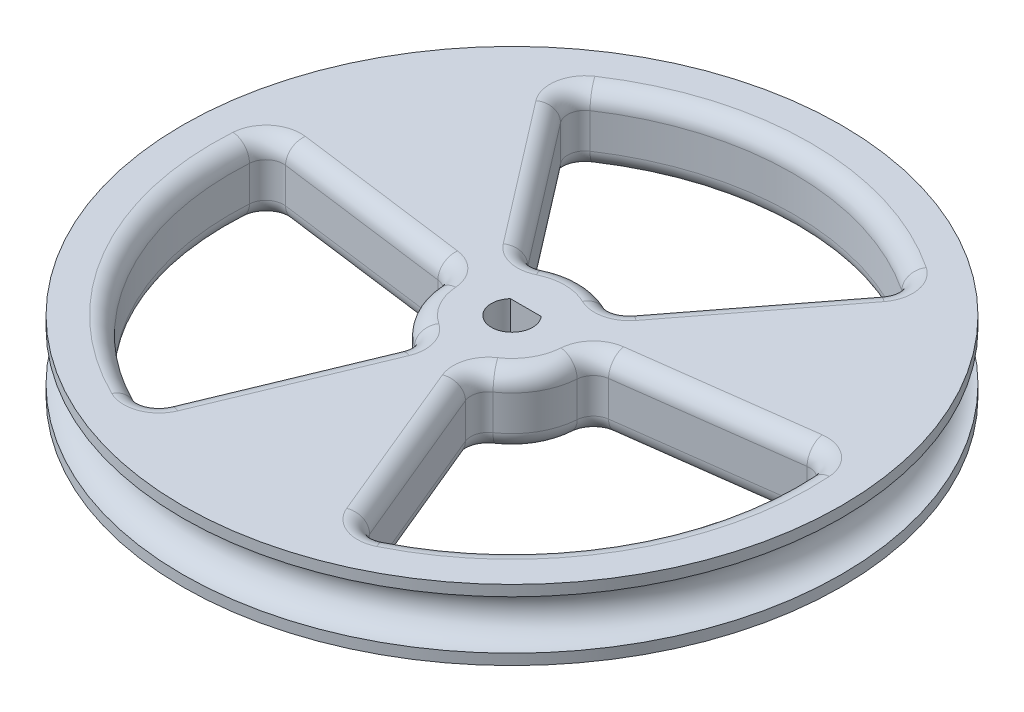
from build123d import *

# Parameters (mm, degrees)
SKETCH1_R                 = 23.815610662
BOSS_EXTRUDE1_DEPTH       = 5.08
CUT_EXTRUDE1_DEPTH        = 5.08
CUT_EXTRUDE3_DEPTH        = 35.061312694
FILLET22_R                = 1.27
CIRPATTERN1_COUNT         = 3
FILLET22_OF_CIRPATTERN1_R = 1.27


with BuildPart() as part:
    # Sketch1 → Boss-Extrude1 (new body)
    with BuildSketch(Plane(origin=(0, 0, 0), x_dir=(1, 0, 0), z_dir=(0, 1, 0))):
        with Locations(Location((0, 0, 0), (0, 0, 270))):
            Circle(SKETCH1_R)
    extrude(amount=BOSS_EXTRUDE1_DEPTH)

    # Sketch2 → Cut-Extrude1 (cut)
    with BuildSketch(Plane(origin=(0, 5.08, 0), x_dir=(1, 0, 0), z_dir=(0, 1, 0))):
        with BuildLine():
            Line((-1.114562695, 0.99225), (1.114562695, 0.99225))
            ThreePointArc((1.114562695, 0.99225), (0, -1.49225), (-1.114562695, 0.99225))
        make_face()
    extrude(amount=-CUT_EXTRUDE1_DEPTH, mode=Mode.SUBTRACT)

    # Sketch5 → Cut-Revolve2 (revolve, cut)
    with BuildSketch(Plane.XY, mode=Mode.PRIVATE) as cut_revolve2_sk:
        with BuildLine():
            Line((-23.815610662, 4.3053), (-23.815610662, 0.7747))
            ThreePointArc((-23.815610662, 0.7747), (-22.050310662, 2.54), (-23.815610662, 4.3053))
        make_face()
    revolve(cut_revolve2_sk.sketch.rotate(Axis((0, 4.3287014, 0), (0, -1, 0)), 270), axis=Axis((0, 4.3287014, 0), (0, -1, 0)), mode=Mode.SUBTRACT)

    # Sketch8 → Cut-Extrude3 (cut, through all)
    with BuildSketch(Plane(origin=(0, 5.08, 0), x_dir=(1, 0, 0), z_dir=(0, 1, 0))):
        with BuildLine():
            Line((3.092508059, 4.030234969), (12.370032237, 16.120939875))
            ThreePointArc((12.370032237, 16.120939875), (0, 20.32), (-12.370032237, 16.120939875))
            Line((-12.370032237, 16.120939875), (-3.092508059, 4.030234969))
            ThreePointArc((-3.092508059, 4.030234969), (0, 5.08), (3.092508059, 4.030234969))
        make_face()
    cut_extrude3 = extrude(amount=-CUT_EXTRUDE3_DEPTH, mode=Mode.SUBTRACT)

    # Fillet22
    fillet22_edges = [part.edges().sort_by_distance(p)[0] for p in [
        (-7.731270148, 0, -10.075587422),
        (-3.092508059, 2.54, -4.030234969),
        (0, 5.08, -20.32),
        (-12.370032237, 2.54, -16.120939875),
        (7.731270148, 0, -10.075587422),
        (12.370032237, 2.54, -16.120939875),
        (0, 0, -5.08),
        (3.092508059, 2.54, -4.030234969),
        (0, 0, -20.32),
        (-7.731270148, 5.08, -10.075587422),
        (0, 5.08, -5.08),
        (7.731270148, 5.08, -10.075587422),
    ]]
    fillet(fillet22_edges, radius=FILLET22_R)

    # CirPattern1: Cut-Extrude3 ×3 about axis
    cirpattern1_axis = Axis((0, 5.08, 0), (0, 1, 0))
    for i in range(1, CIRPATTERN1_COUNT):
        add(cut_extrude3.rotate(cirpattern1_axis, i * 360 / CIRPATTERN1_COUNT), mode=Mode.SUBTRACT)

    # Fillet22 of CirPattern1
    fillet22_of_cirpattern1_edges = [part.edges().sort_by_distance(p)[0] for p in [
        (-4.860079591, 0, 11.733270063),
        (-1.944031836, 2.54, 4.693308025),
        (-17.597636205, 5.08, 10.16),
        (-7.776127346, 2.54, 18.773232101),
        (-12.591349739, 0, -1.657682641),
        (-20.146159583, 2.54, -2.652292226),
        (-4.399409051, 0, 2.54),
        (-5.036539896, 2.54, -0.663073056),
        (-17.597636205, 0, 10.16),
        (-4.860079591, 5.08, 11.733270063),
        (-4.399409051, 5.08, 2.54),
        (-12.591349739, 5.08, -1.657682641),
        (12.591349739, 0, -1.657682641),
        (5.036539896, 2.54, -0.663073056),
        (17.597636205, 5.08, 10.16),
        (20.146159583, 2.54, -2.652292226),
        (4.860079591, 0, 11.733270063),
        (7.776127346, 2.54, 18.773232101),
        (4.399409051, 0, 2.54),
        (1.944031836, 2.54, 4.693308025),
        (17.597636205, 0, 10.16),
        (12.591349739, 5.08, -1.657682641),
        (4.399409051, 5.08, 2.54),
        (4.860079591, 5.08, 11.733270063),
    ]]
    fillet(fillet22_of_cirpattern1_edges, radius=FILLET22_OF_CIRPATTERN1_R)


solid = part.part
